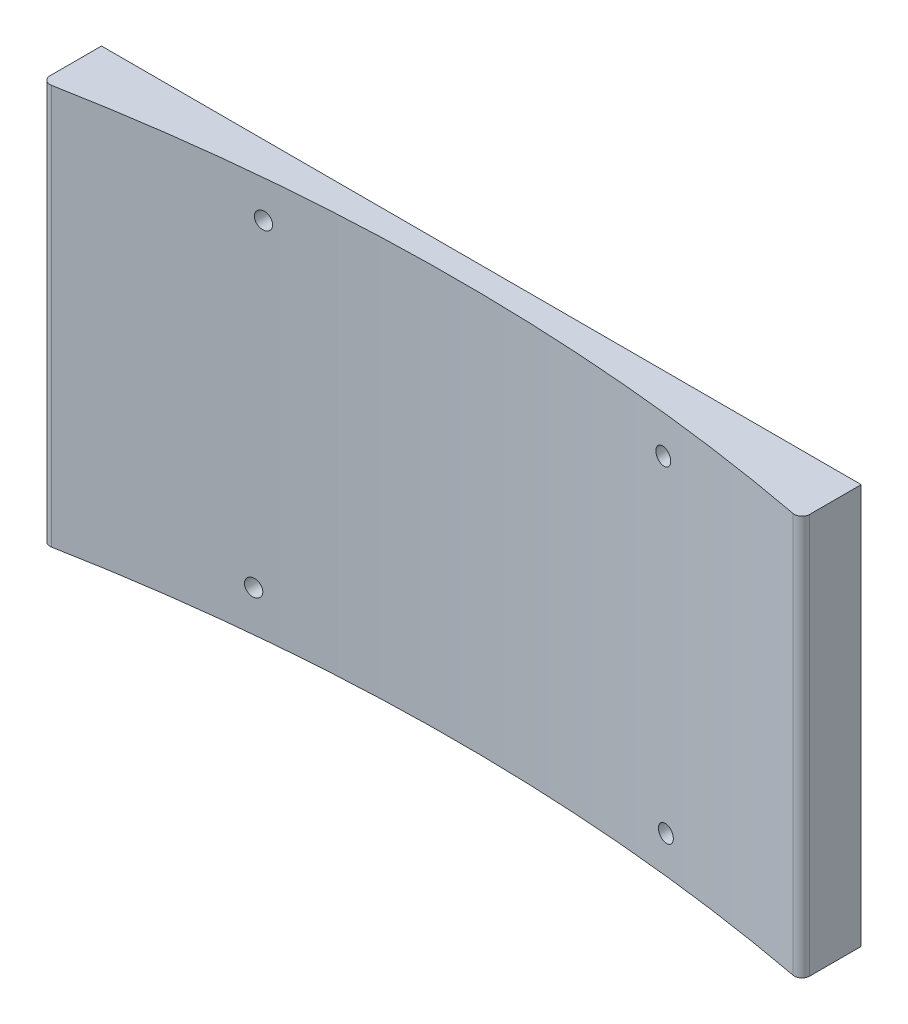
from build123d import *

# Parameters (mm, degrees)
BOSS_EXTRUDE1_START = 20
BOSS_EXTRUDE1_DEPTH = 2
BOSS_EXTRUDE2_DEPTH = 52.64
SKETCH5_R           = 1.1
CUT_EXTRUDE2_DEPTH  = 19.64
SKETCH5_5_R         = 1.1
CUT_EXTRUDE3_DEPTH  = 19.64
SKETCH5_6_R         = 1.1
CUT_EXTRUDE4_DEPTH  = 19.64
SKETCH5_7_R         = 1.1
CUT_EXTRUDE5_DEPTH  = 19.64
FILLET1_R           = 1
FILLET2_R           = 1


with BuildPart() as part:
    # Sketch2 → Boss-Extrude1 (new body)
    with BuildSketch(Plane.XY.offset(BOSS_EXTRUDE1_START)):
        Polygon((-121.572, 80.424), (-41.572, 80.424), (-41.572, 27.78), (-141.572, 27.78), (-141.572, 80.424), align=None)
    extrude(amount=BOSS_EXTRUDE1_DEPTH)

    # Sketch3 → Boss-Extrude2 (add)
    with BuildSketch(Plane(origin=(0, 80.424, 0), x_dir=(1, 0, 0), z_dir=(0, 1, 0))):
        with BuildLine():
            Line((-41.572, -28), (-41.572, -22))
            Line((-41.572, -22), (-141.572, -22))
            Line((-141.572, -22), (-141.572, -28))
            ThreePointArc((-141.572, -28), (-91.572, -23.213616387), (-41.572, -28))
        make_face()
    extrude(amount=-BOSS_EXTRUDE2_DEPTH)

    # Sketch5 → Cut-Extrude2 (cut)
    with BuildSketch(Plane(origin=(0, 0, 20), x_dir=(-1, 0, 0), z_dir=(0, 0, -1))):
        with Locations((62.455, 32.641)):
            Circle(SKETCH5_R)
    extrude(amount=-CUT_EXTRUDE2_DEPTH, mode=Mode.SUBTRACT)

    # Sketch5<5> → Cut-Extrude3 (cut)
    with BuildSketch(Plane(origin=(0, 0, 20), x_dir=(-1, 0, 0), z_dir=(0, 0, -1))):
        with Locations((62.836, 75.44)):
            Circle(SKETCH5_5_R)
    extrude(amount=-CUT_EXTRUDE3_DEPTH, mode=Mode.SUBTRACT)

    # Sketch5<6> → Cut-Extrude4 (cut)
    with BuildSketch(Plane(origin=(0, 0, 20), x_dir=(-1, 0, 0), z_dir=(0, 0, -1))):
        with Locations((115.905, 75.538)):
            Circle(SKETCH5_6_R)
    extrude(amount=-CUT_EXTRUDE4_DEPTH, mode=Mode.SUBTRACT)

    # Sketch5<7> → Cut-Extrude5 (cut)
    with BuildSketch(Plane(origin=(0, 0, 20), x_dir=(-1, 0, 0), z_dir=(0, 0, -1))):
        with Locations((117.094, 33.147)):
            Circle(SKETCH5_7_R)
    extrude(amount=-CUT_EXTRUDE5_DEPTH, mode=Mode.SUBTRACT)

    # Fillet1
    fillet1_edges = [part.edges().sort_by_distance(p)[0] for p in [
        (-41.572, 54.104, 28),
    ]]
    fillet(fillet1_edges, radius=FILLET1_R)

    # Fillet2
    fillet2_edges = [part.edges().sort_by_distance(p)[0] for p in [
        (-141.572, 54.104, 28),
    ]]
    fillet(fillet2_edges, radius=FILLET2_R)


solid = part.part
